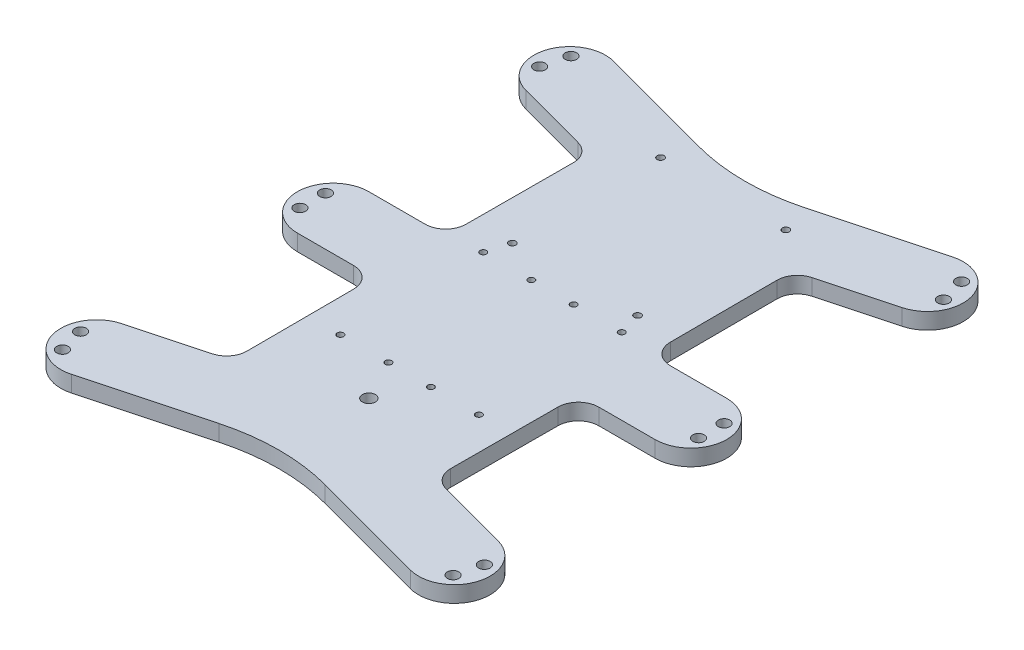
from build123d import *

# Parameters (mm, degrees)
BOSS_EXTRUDE1_DEPTH = 6.35
FILLET1_R           = 80
FILLET2_R           = 8
SKETCH2_R           = 1.35
CUT_EXTRUDE1_DEPTH  = 136.852736293
SKETCH3_R           = 1.25
CUT_EXTRUDE2_DEPTH  = 136.852736293
SKETCH5_R           = 2.55
CUT_EXTRUDE3_DEPTH  = 136.852736293
SKETCH7_R           = 2.25
CUT_EXTRUDE4_DEPTH  = 10


with BuildPart() as part:
    # Sketch1 → Boss-Extrude1 (new body)
    with BuildSketch(Plane(origin=(0, 0, 0), x_dir=(1, 0, 0), z_dir=(0, 1, 0))):
        with BuildLine():
            Line((-70, 14), (-40, 14))
            Line((-40, 14), (-39.816062711, 70))
            Line((-39.816062711, 70), (-73.623466631, 79.058666579))
            ThreePointArc((-73.623466631, 79.058666579), (-83.522961568, 96.205094778), (-66.376533369, 106.104589715))
            Line((-66.376533369, 106.104589715), (0, 88.319051202))
            Line((0, 88.319051202), (66.376533369, 106.104589715))
            ThreePointArc((66.376533369, 106.104589715), (83.522961568, 96.205094778), (73.623466631, 79.058666579))
            Line((73.623466631, 79.058666579), (39.816062711, 70))
            Line((39.816062711, 70), (40, 14))
            Line((40, 14), (70, 14))
            ThreePointArc((70, 14), (84, 0), (70, -14))
            Line((70, -14), (40, -14))
            Line((40, -14), (39.816062711, -70))
            Line((39.816062711, -70), (73.623466631, -79.058666579))
            ThreePointArc((73.623466631, -79.058666579), (83.522961568, -96.205094778), (66.376533369, -106.104589715))
            Line((66.376533369, -106.104589715), (0, -88.319051202))
            Line((0, -88.319051202), (-66.376533369, -106.104589715))
            ThreePointArc((-66.376533369, -106.104589715), (-83.522961568, -96.205094778), (-73.623466631, -79.058666579))
            Line((-73.623466631, -79.058666579), (-39.816062711, -70))
            Line((-39.816062711, -70), (-40, -14))
            Line((-40, -14), (-70, -14))
            ThreePointArc((-70, -14), (-84, 0), (-70, 14))
        make_face()
    extrude(amount=BOSS_EXTRUDE1_DEPTH)

    # Fillet1
    fillet1_edges = [part.edges().sort_by_distance(p)[0] for p in [
        (0, 3.175, -88.319051202),
        (0, 3.175, 88.319051202),
    ]]
    fillet(fillet1_edges, radius=FILLET1_R)

    # Fillet2
    fillet2_edges = [part.edges().sort_by_distance(p)[0] for p in [
        (-40, 3.175, -14),
        (-39.816062711, 3.175, -70),
        (39.816062711, 3.175, -70),
        (40, 3.175, -14),
        (40, 3.175, 14),
        (39.816062711, 3.175, 70),
        (-39.816062711, 3.175, 70),
        (-40, 3.175, 14),
    ]]
    fillet(fillet2_edges, radius=FILLET2_R)

    # Sketch2 → Cut-Extrude1 (cut, through all)
    with BuildSketch(Plane(origin=(0, 6.35, 0), x_dir=(1, 0, 0), z_dir=(0, 1, 0))):
        with Locations(Location((-24.5, 24.641145635, 0), (0, 0, 270))):
            Circle(SKETCH2_R)
        with Locations(Location((24.5, 24.641145635, 0), (0, 0, 270))):
            Circle(SKETCH2_R)
        with Locations(Location((24.5, 82.641145635, 0), (0, 0, 270))):
            Circle(SKETCH2_R)
        with Locations(Location((-24.5, 82.641145635, 0), (0, 0, 270))):
            Circle(SKETCH2_R)
    extrude(amount=-CUT_EXTRUDE1_DEPTH, mode=Mode.SUBTRACT)

    # Sketch3 → Cut-Extrude2 (cut, through all)
    with BuildSketch(Plane(origin=(0, 6.35, 0), x_dir=(1, 0, 0), z_dir=(0, 1, 0))):
        with Locations(Location((-8.3, -40.058854365, 0), (0, 0, 270))):
            Circle(SKETCH3_R)
        with Locations(Location((-27.1, -40.058854365, 0), (0, 0, 270))):
            Circle(SKETCH3_R)
        with Locations(Location((-27.1, 15.841145635, 0), (0, 0, 270))):
            Circle(SKETCH3_R)
        with Locations(Location((-8.3, 15.841145635, 0), (0, 0, 270))):
            Circle(SKETCH3_R)
        with Locations(Location((8.3, 15.841145635, 0), (0, 0, 270))):
            Circle(SKETCH3_R)
        with Locations(Location((27.1, 15.841145635, 0), (0, 0, 270))):
            Circle(SKETCH3_R)
        with Locations(Location((8.3, -40.058854365, 0), (0, 0, 270))):
            Circle(SKETCH3_R)
        with Locations(Location((27.1, -40.058854365, 0), (0, 0, 270))):
            Circle(SKETCH3_R)
    extrude(amount=-CUT_EXTRUDE2_DEPTH, mode=Mode.SUBTRACT)

    # Sketch5 → Cut-Extrude3 (cut, through all)
    with BuildSketch(Plane(origin=(0, 6.35, 0), x_dir=(1, 0, 0), z_dir=(0, 1, 0))):
        with Locations(Location((0, -56.018854365, 0), (0, 0, 270))):
            Circle(SKETCH5_R)
    extrude(amount=-CUT_EXTRUDE3_DEPTH, mode=Mode.SUBTRACT)

    # Sketch7 → Cut-Extrude4 (cut)
    with BuildSketch(Plane(origin=(0, 6.35, 0), x_dir=(1, 0, 0), z_dir=(0, 1, 0))):
        with Locations(Location((-76.433311385, -99.481809639, 0), (0, 0, 270))):
            Circle(SKETCH7_R)
        with Locations(Location((-79.021501836, -89.822551376, 0), (0, 0, 270))):
            Circle(SKETCH7_R)
        with Locations(Location((-78, -5, 0), (0, 0, 270))):
            Circle(SKETCH7_R)
        with Locations(Location((-78, 5, 0), (0, 0, 270))):
            Circle(SKETCH7_R)
        with Locations(Location((-79.021501836, 89.822551376, 0), (0, 0, 270))):
            Circle(SKETCH7_R)
        with Locations(Location((-76.433311385, 99.481809639, 0), (0, 0, 270))):
            Circle(SKETCH7_R)
        with Locations(Location((79.021501836, 89.822551376, 0), (0, 0, 270))):
            Circle(SKETCH7_R)
        with Locations(Location((76.433311385, 99.481809639, 0), (0, 0, 270))):
            Circle(SKETCH7_R)
        with Locations(Location((78, -5, 0), (0, 0, 270))):
            Circle(SKETCH7_R)
        with Locations(Location((78, 5, 0), (0, 0, 270))):
            Circle(SKETCH7_R)
        with Locations(Location((79.021501836, -89.822551376, 0), (0, 0, 270))):
            Circle(SKETCH7_R)
        with Locations(Location((76.433311385, -99.481809639, 0), (0, 0, 270))):
            Circle(SKETCH7_R)
    extrude(amount=-CUT_EXTRUDE4_DEPTH, mode=Mode.SUBTRACT)


solid = part.part
